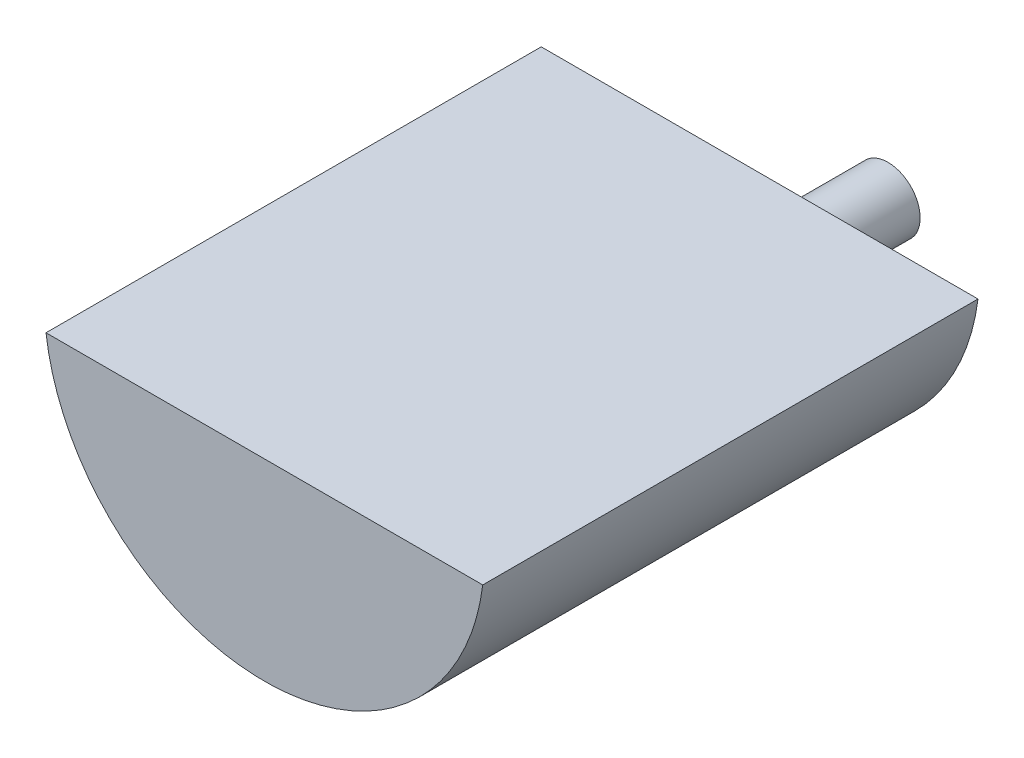
from build123d import *

# Parameters (mm, degrees)
SKETCH1_R           = 24
BOSS_EXTRUDE1_DEPTH = 54
SKETCH2_W           = 90.000197778
SKETCH2_H           = 36.253247866
CUT_EXTRUDE1_DEPTH  = 64.780874876
SKETCH3_R           = 3.5
SKETCH3_R_2         = 1
BOSS_EXTRUDE2_DEPTH = 14
CUT_EXTRUDE2_DEPTH  = 48
CUT_EXTRUDE3_START  = -3
SKETCH5_R           = 1
CUT_EXTRUDE3_DEPTH  = 3


with BuildPart() as part:
    # Sketch1 → Boss-Extrude1 (new body)
    with BuildSketch(Plane.XY):
        Circle(SKETCH1_R)
    extrude(amount=BOSS_EXTRUDE1_DEPTH)

    # Sketch2 → Cut-Extrude1 (cut, through all)
    with BuildSketch(Plane(origin=(0, 0, 0), x_dir=(-1, 0, 0), z_dir=(0, 0, -1))):
        with Locations((-2.008073343, 15.126623933)):
            Rectangle(SKETCH2_W, SKETCH2_H)
    extrude(amount=-CUT_EXTRUDE1_DEPTH, mode=Mode.SUBTRACT)

    # Sketch3 → Boss-Extrude2 (add)
    with BuildSketch(Plane(origin=(0, 0, 0), x_dir=(-1, 0, 0), z_dir=(0, 0, -1))):
        with Locations(Location((0, -12.5, 0), (0, 0, 180))):
            Circle(SKETCH3_R)
        with Locations((0, -12.5)):
            Circle(SKETCH3_R_2, mode=Mode.SUBTRACT)
    extrude(amount=BOSS_EXTRUDE2_DEPTH)

    # Sketch4 → Cut-Extrude2 (cut)
    with BuildSketch(Plane.XY.offset(51)):
        with BuildLine():
            Line((20.124611797, -6), (-20.124611797, -6))
            ThreePointArc((-20.124611797, -6), (0, -21), (20.124611797, -6))
        make_face()
    extrude(amount=-CUT_EXTRUDE2_DEPTH, mode=Mode.SUBTRACT)

    # Sketch5 → Cut-Extrude3 (cut)
    with BuildSketch(Plane(origin=(0, 0, 0), x_dir=(-1, 0, 0), z_dir=(0, 0, -1)).offset(CUT_EXTRUDE3_START)):
        with Locations((0, -12.5)):
            Circle(SKETCH5_R)
    extrude(amount=CUT_EXTRUDE3_DEPTH, mode=Mode.SUBTRACT)


solid = part.part
